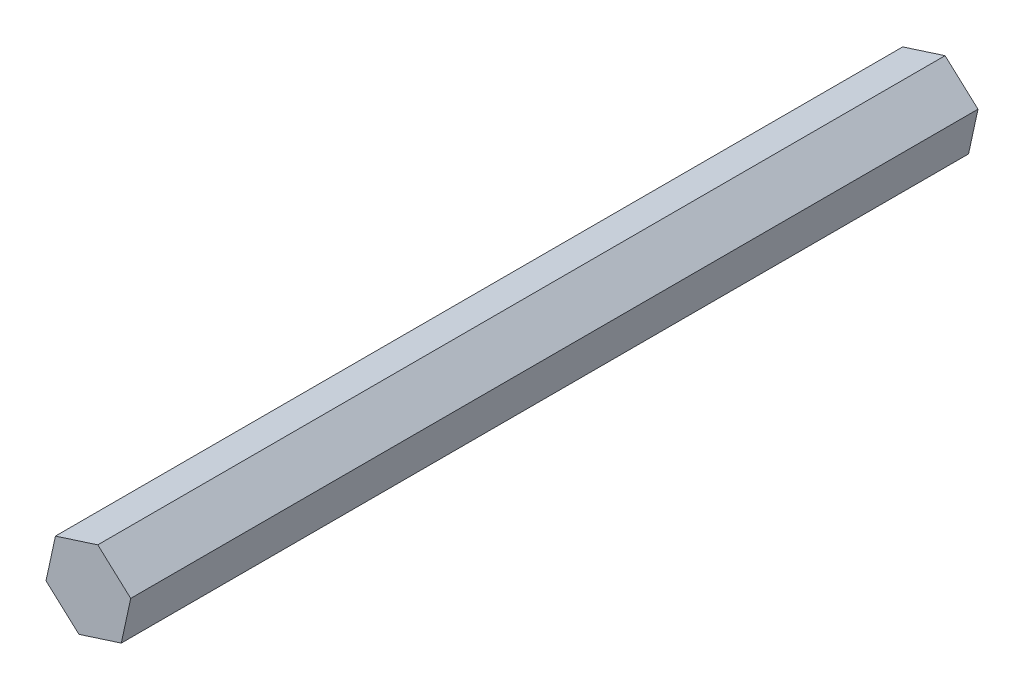
from build123d import *

# Parameters (mm, degrees)
BOSS_EXTRUDE1_DEPTH = 55


with BuildPart() as part:
    # Sketch1 → Boss-Extrude1 (new body)
    with BuildSketch(Plane.XY):
        Polygon((2.137295047, -1.940438924), (2.749116926, 0.880732344), (0.611821879, 2.821171268), (-2.137295047, 1.940438924), (-2.749116926, -0.880732344), (-0.611821879, -2.821171268), align=None)
    extrude(amount=BOSS_EXTRUDE1_DEPTH)


solid = part.part
